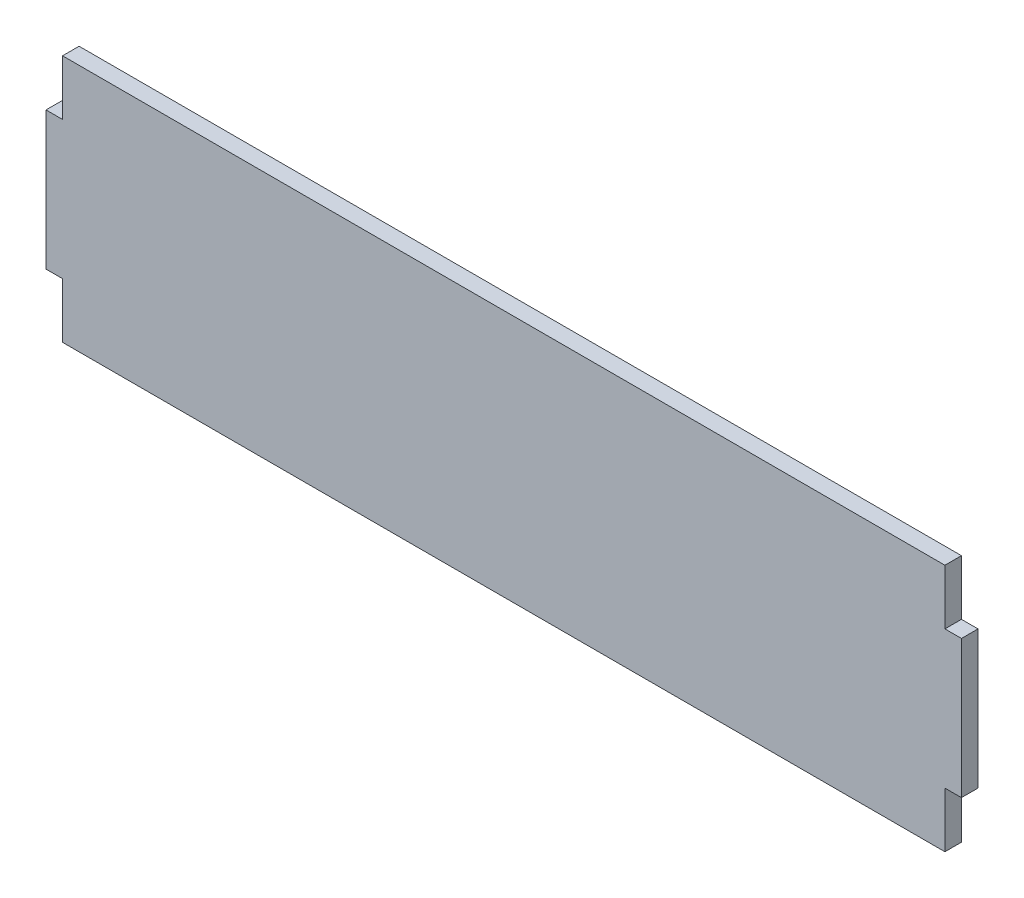
from build123d import *

# Parameters (mm, degrees)
BOSS_EXTRUDE1_DEPTH = 6


with BuildPart() as part:
    # Sketch1 → Boss-Extrude1 (new body)
    with BuildSketch(Plane.XY):
        Polygon((-160, 62.891566265), (160, 62.891566265), (160, 42.891566265), (166, 42.891566265), (166, -7.108433735), (160, -7.108433735), (160, -27.108433735), (-160, -27.108433735), (-160, -7.108433735), (-166, -7.108433735), (-166, 42.891566265), (-160, 42.891566265), align=None)
    extrude(amount=BOSS_EXTRUDE1_DEPTH)


solid = part.part
